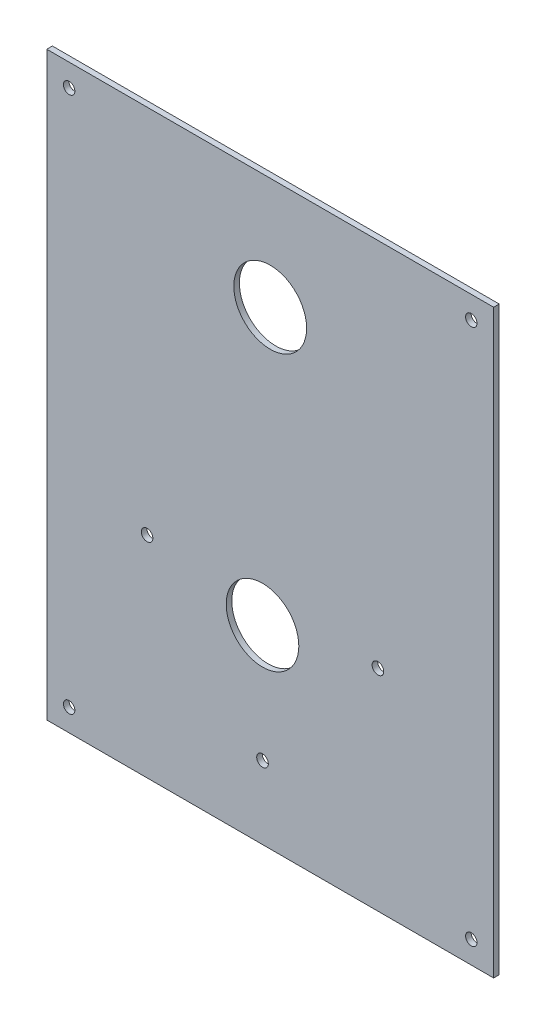
from build123d import *

# Parameters (mm, degrees)
SKETCH1_W           = 254
SKETCH1_H           = 330.2
BOSS_EXTRUDE1_DEPTH = 3.175
SKETCH2_R           = 20.701
CUT_EXTRUDE1_DEPTH  = 301.262663605
SKETCH3_R           = 3.3
SKETCH3_R_2         = 20.6375
SKETCH3_R_3         = 3.2512
CUT_EXTRUDE2_DEPTH  = 301.262663605


with BuildPart() as part:
    # Sketch1 → Boss-Extrude1 (new body)
    with BuildSketch(Plane.XY):
        with Locations((19.981406387, -96.70919141)):
            Rectangle(SKETCH1_W, SKETCH1_H)
    extrude(amount=-BOSS_EXTRUDE1_DEPTH)

    # Sketch2 → Cut-Extrude1 (cut, through all)
    with BuildSketch(Plane.XY):
        with Locations((19.981406387, 4.89080859)):
            Circle(SKETCH2_R)
    extrude(amount=-CUT_EXTRUDE1_DEPTH, mode=Mode.SUBTRACT)

    # Sketch3 → Cut-Extrude2 (cut, through all)
    with BuildSketch(Plane.XY):
        with Locations((-50.007395692, -142.229557515)):
            Circle(SKETCH3_R)
        with Locations((81.218237397, -142.229557515)):
            Circle(SKETCH3_R)
        with Locations((15.605420852, -220.423867352)):
            Circle(SKETCH3_R)
        with Locations((15.605420852, -153.798867352)):
            Circle(SKETCH3_R_2)
        with Locations((134.281406387, 55.69080859)):
            Circle(SKETCH3_R_3)
        with Locations((-94.318593613, 55.69080859)):
            Circle(SKETCH3_R_3)
        with Locations((134.281406387, -249.10919141)):
            Circle(SKETCH3_R_3)
        with Locations((-94.318593613, -249.10919141)):
            Circle(SKETCH3_R_3)
    extrude(amount=-CUT_EXTRUDE2_DEPTH, mode=Mode.SUBTRACT)


solid = part.part
